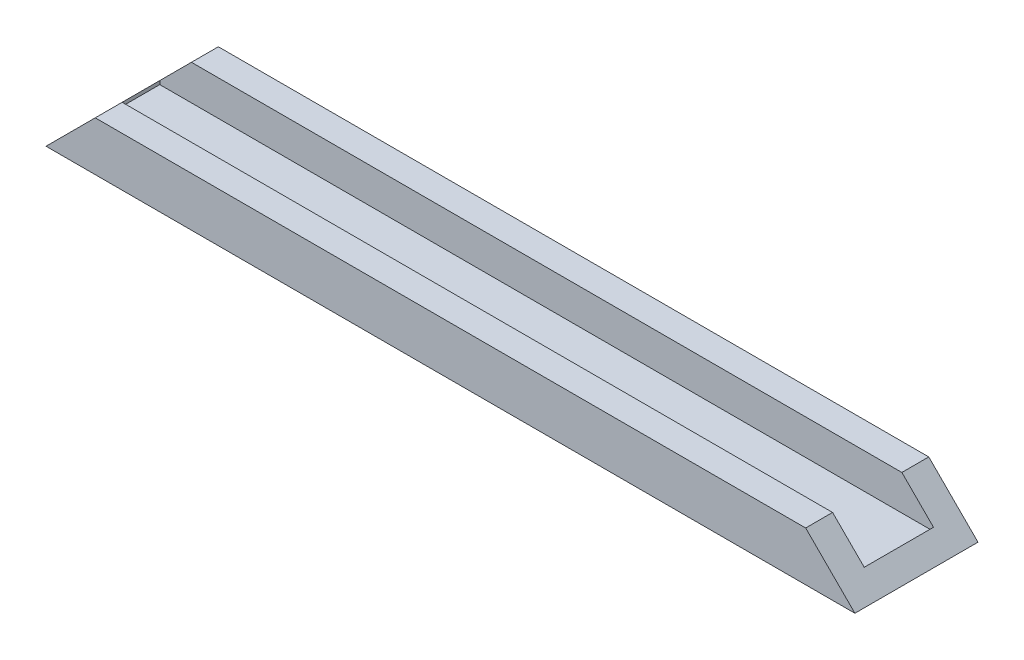
from build123d import *

# Parameters (mm, degrees)
SKETCH1_W          = 146.05
SKETCH1_H          = 22.225
BASE_EXTRUDE_DEPTH = 8.89
SKETCH3_W          = 139.7
SKETCH3_H          = 12.5095
PIECE_CUT_DEPTH    = 6.35
CORNER_CUT_DEPTH   = 148.998598726


with BuildPart() as part:
    # Sketch1 → Base Extrude (new body)
    with BuildSketch(Plane(origin=(0, 0, 0), x_dir=(1, 0, 0), z_dir=(0, 1, 0))):
        with Locations((73.025, 11.1125)):
            Rectangle(SKETCH1_W, SKETCH1_H)
    extrude(amount=BASE_EXTRUDE_DEPTH)

    # Sketch3 → Piece Cut (cut)
    with BuildSketch(Plane(origin=(0, 8.89, 0), x_dir=(1, 0, 0), z_dir=(0, 1, 0))):
        with Locations((73.025, 11.1125)):
            Rectangle(SKETCH3_W, SKETCH3_H)
    extrude(amount=-PIECE_CUT_DEPTH, mode=Mode.SUBTRACT)

    # Sketch4 → Corner Cut (cut, through all)
    with BuildSketch(Plane(origin=(0, 0, -22.225), x_dir=(-1, 0, 0), z_dir=(0, 0, -1))):
        Polygon((0, 0), (-8.89, 8.89), (0, 8.89), align=None)
        Polygon((-146.05, 8.89), (-137.16, 8.89), (-146.05, 0), align=None)
    extrude(amount=-CORNER_CUT_DEPTH, mode=Mode.SUBTRACT)


solid = part.part
